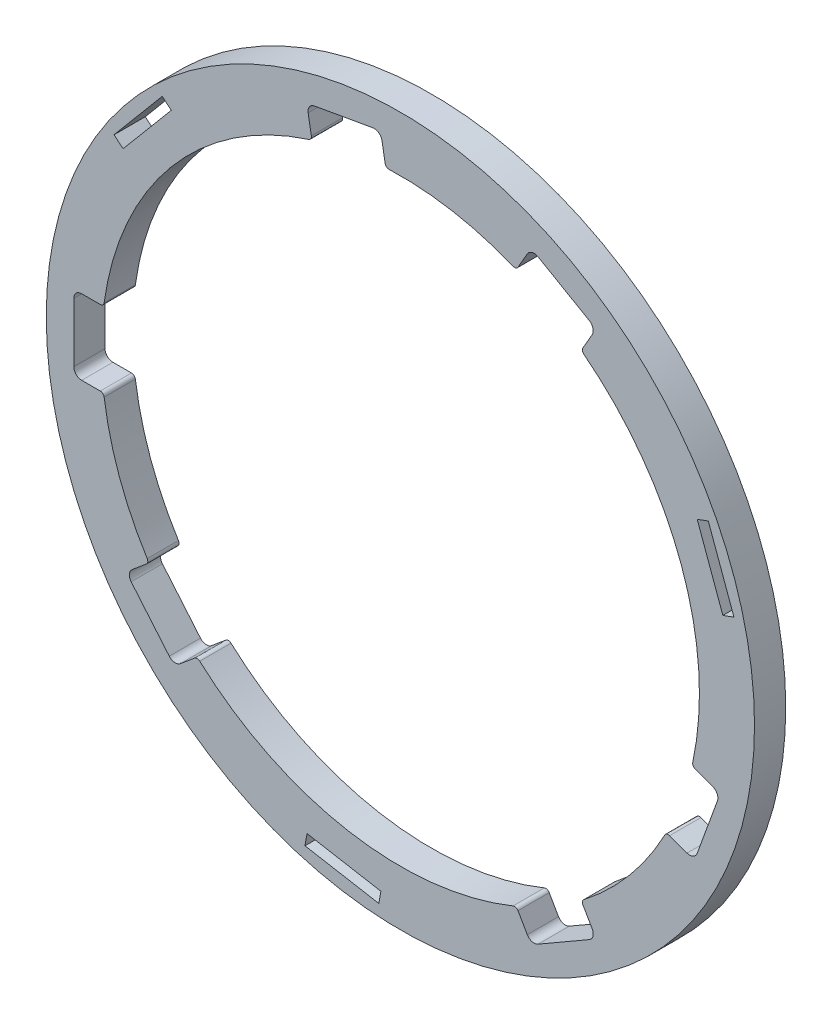
from build123d import *

# Parameters (mm, degrees)
SKETCH1_R           = 22.5
BOSS_EXTRUDE1_DEPTH = 1.984375
FILLET1_R           = 0.25
FILLET2_R           = 0.5


with BuildPart() as part:
    # Sketch1 → Boss-Extrude1 (new body)
    with BuildSketch(Plane.XY):
        with Locations((0, -0.070071084)):
            Circle(SKETCH1_R)
        with BuildLine():
            Line((-1.258126225, 20.778189514), (-0.928227613, 18.907241516))
            ThreePointArc((-0.928227613, 18.907241516), (3.299315376, 18.641276223), (7.362871814, 17.445296987))
            Line((7.362871814, 17.445296987), (8.312777007, 19.090581045))
            Line((8.312777007, 19.090581045), (12.437222993, 16.709331045))
            Line((12.437222993, 16.709331045), (11.487317799, 15.064046987))
            ThreePointArc((11.487317799, 15.064046987), (17.854159795, 6.428311639), (18.527819546, -4.279572584))
            Line((18.527819546, -4.279572584), (20.313057348, -4.929346005))
            Line((20.313057348, -4.929346005), (18.684186415, -9.404632111))
            Line((18.684186415, -9.404632111), (16.898948613, -8.75485869))
            ThreePointArc((16.898948613, -8.75485869), (14.554844419, -12.283035668), (11.487317799, -15.204189155))
            Line((11.487317799, -15.204189155), (12.437222993, -16.849473212))
            Line((12.437222993, -16.849473212), (8.312777007, -19.230723212))
            Line((8.312777007, -19.230723212), (7.362871814, -17.585439155))
            ThreePointArc((7.362871814, -17.585439155), (-3.299315376, -18.781418391), (-12.909445009, -14.010882737))
            Line((-12.909445009, -14.010882737), (-14.364784199, -15.232057315))
            Line((-14.364784199, -15.232057315), (-17.42606019, -11.583770655))
            Line((-17.42606019, -11.583770655), (-15.970721, -10.362596077))
            ThreePointArc((-15.970721, -10.362596077), (-17.854159795, -6.568453807), (-18.850189613, -2.451321084))
            Line((-18.850189613, -2.451321084), (-20.75, -2.451321084))
            Line((-20.75, -2.451321084), (-20.75, 2.311178916))
            Line((-20.75, 2.311178916), (-18.850189613, 2.311178916))
            ThreePointArc((-18.850189613, 2.311178916), (-14.554844419, 12.1428935), (-5.618374537, 18.080242069))
            Line((-5.618374537, 18.080242069), (-5.948273148, 19.951190068))
            Line((-5.948273148, 19.951190068), (-1.258126225, 20.778189514))
        make_face(mode=Mode.SUBTRACT)
        Polygon((20.377631163, 7.473973659), (21.19206663, 5.236330606), (20.487297164, 4.979815499), (19.672861698, 7.217458552), (18.858426231, 9.455101605), (19.563195697, 9.711616713), align=None, mode=Mode.SUBTRACT)
        Polygon((-14.55629531, 15.25261205), (-15.130828642, 15.734702757), (-16.661466638, 13.910559427), (-18.192104633, 12.086416097), (-17.617571301, 11.604325389), (-16.086933305, 13.428468719), align=None, mode=Mode.SUBTRACT)
        Polygon((-3.716164525, -21.384533086), (-6.061237987, -20.971033363), (-5.931001854, -20.232427548), (-3.585928392, -20.645927271), (-1.24085493, -21.059426994), (-1.371091064, -21.798032809), align=None, mode=Mode.SUBTRACT)
    extrude(amount=BOSS_EXTRUDE1_DEPTH)

    # Fillet1
    fillet1_edges = [part.edges().sort_by_distance(p)[0] for p in [
        (-18.850189613, -2.451321084, 0.9921875),
        (-15.970721, -10.362596077, 0.9921875),
        (-12.909445009, -14.010882737, 0.9921875),
        (7.362871814, -17.585439155, 0.9921875),
        (11.487317799, -15.204189155, 0.9921875),
        (16.898948613, -8.75485869, 0.9921875),
        (18.527819546, -4.279572584, 0.9921875),
        (11.487317799, 15.064046987, 0.9921875),
        (7.362871814, 17.445296987, 0.9921875),
        (-0.928227613, 18.907241516, 0.9921875),
        (-5.618374537, 18.080242069, 0.9921875),
        (-18.850189613, 2.311178916, 0.9921875),
    ]]
    fillet(fillet1_edges, radius=FILLET1_R)

    # Fillet2
    fillet2_edges = [part.edges().sort_by_distance(p)[0] for p in [
        (-17.42606019, -11.583770655, 0.9921875),
        (-14.364784199, -15.232057315, 0.9921875),
        (8.312777007, -19.230723212, 0.9921875),
        (12.437222993, -16.849473212, 0.9921875),
        (18.684186415, -9.404632111, 0.9921875),
        (20.313057348, -4.929346005, 0.9921875),
        (12.437222993, 16.709331045, 0.9921875),
        (8.312777007, 19.090581045, 0.9921875),
        (-1.258126225, 20.778189514, 0.9921875),
        (-5.948273148, 19.951190068, 0.9921875),
        (-20.75, 2.311178916, 0.9921875),
        (-20.75, -2.451321084, 0.9921875),
    ]]
    fillet(fillet2_edges, radius=FILLET2_R)


solid = part.part
